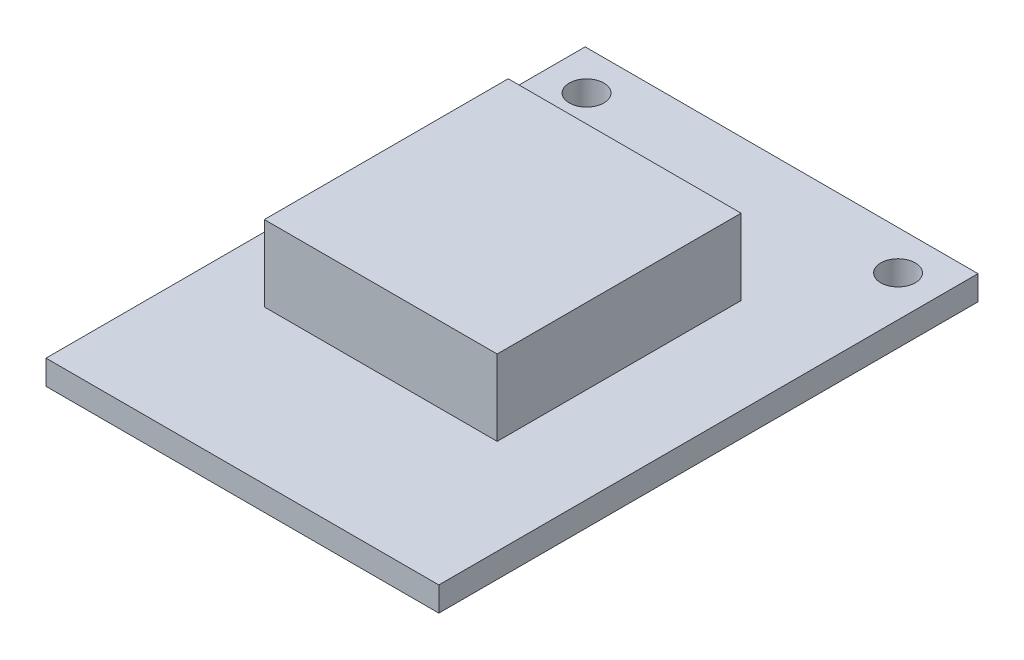
from build123d import *

# Parameters (mm, degrees)
SKETCH1_W           = 25.5
SKETCH1_H           = 35
BOSS_EXTRUDE1_DEPTH = 1.5875
SKETCH2_W           = 15.116457136
SKETCH2_H           = 15.832029072
BOSS_EXTRUDE2_DEPTH = 4.9125
CUT_EXTRUDE1_REACH  = 24.202
SKETCH3_R           = 1.122559654


with BuildPart() as part:
    # Sketch1 → Boss-Extrude1 (new body)
    with BuildSketch(Plane(origin=(0, 0, 0), x_dir=(1, 0, 0), z_dir=(0, 1, 0))):
        Rectangle(SKETCH1_W, SKETCH1_H)
    extrude(amount=BOSS_EXTRUDE1_DEPTH)

    # Sketch2 → Boss-Extrude2 (add)
    with BuildSketch(Plane(origin=(0, 1.5875, 0), x_dir=(1, 0, 0), z_dir=(0, 1, 0))):
        with Locations((-0.983911411, 0.380147591)):
            Rectangle(SKETCH2_W, SKETCH2_H)
    extrude(amount=BOSS_EXTRUDE2_DEPTH)

    # Sketch3 → Cut-Extrude1 (cut, up to next)
    with BuildSketch(Plane(origin=(0, 1.5875, 0), x_dir=(1, 0, 0), z_dir=(0, 1, 0)), mode=Mode.PRIVATE) as cut_extrude1_sk1:
        with Locations(Location((-10.110032203, 14.949417208, 0), (0, 0, 270))):
            Circle(SKETCH3_R)
    cut_extrude1_tool1 = extrude(cut_extrude1_sk1.sketch, amount=-CUT_EXTRUDE1_REACH, mode=Mode.PRIVATE) & part.part
    # Sketch3 → Cut-Extrude1 (cut, up to next)
    with BuildSketch(Plane(origin=(0, 1.5875, 0), x_dir=(1, 0, 0), z_dir=(0, 1, 0)), mode=Mode.PRIVATE) as cut_extrude1_sk2:
        with Locations(Location((10.110032203, 14.949417208, 0), (0, 0, 270))):
            Circle(SKETCH3_R)
    cut_extrude1_tool2 = extrude(cut_extrude1_sk2.sketch, amount=-CUT_EXTRUDE1_REACH, mode=Mode.PRIVATE) & part.part
    add(cut_extrude1_tool1.solids().sort_by_distance((-10.110032, 1.5875, -14.949417))[0], mode=Mode.SUBTRACT)
    add(cut_extrude1_tool2.solids().sort_by_distance((10.110032, 1.5875, -14.949417))[0], mode=Mode.SUBTRACT)


solid = part.part
